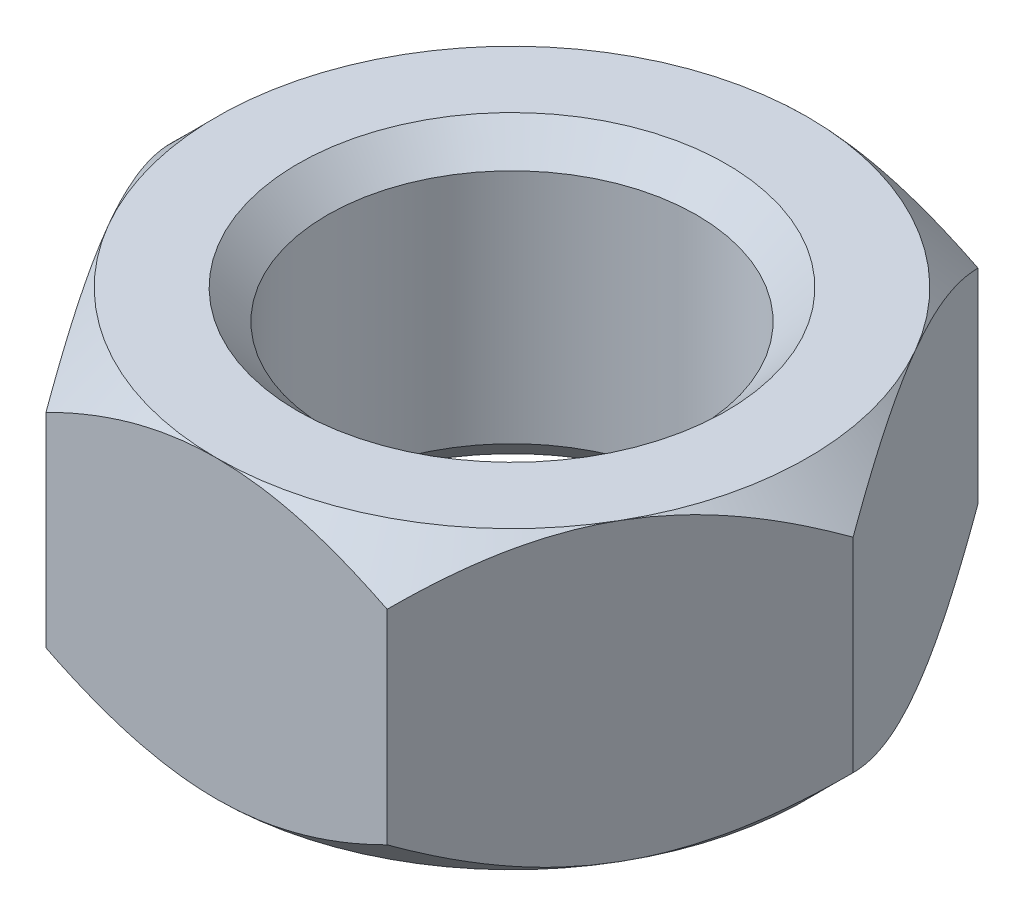
from build123d import *

# Parameters (mm, degrees)
SKETCH1_R           = 2.5
BOSS_EXTRUDE1_DEPTH = 4
CHAMFER1_SIZE       = 0.4


with BuildPart() as part:
    # Sketch1 → Boss-Extrude1 (new body)
    with BuildSketch(Plane(origin=(0, 0, 0), x_dir=(1, 0, 0), z_dir=(0, 1, 0))):
        Polygon((4.618802154, 0), (2.309401077, 4), (-2.309401077, 4), (-4.618802154, 0), (-2.309401077, -4), (2.309401077, -4), align=None)
        with Locations(Location((0, 0, 0), (0, 0, 270))):
            Circle(SKETCH1_R, mode=Mode.SUBTRACT)
    extrude(amount=BOSS_EXTRUDE1_DEPTH)

    # Sketch3 → Cut-Revolve1 (revolve, cut)
    with BuildSketch(Plane(origin=(0, 0, 0), x_dir=(0, 0, -1), z_dir=(1, 0, 0))):
        Polygon((-4, 0), (-5, 1), (-5, 0), align=None)
        Polygon((-5, 4), (-4, 4), (-5, 3), align=None)
    revolve(axis=Axis((0, 0, 0), (0, 1, 0)), mode=Mode.SUBTRACT)

    # Chamfer1
    chamfer1_edges = [part.edges().sort_by_distance(p)[0] for p in [
        (0, 0, -2.5),
        (0, 4, -2.5),
    ]]
    chamfer(chamfer1_edges, length=CHAMFER1_SIZE)


solid = part.part
